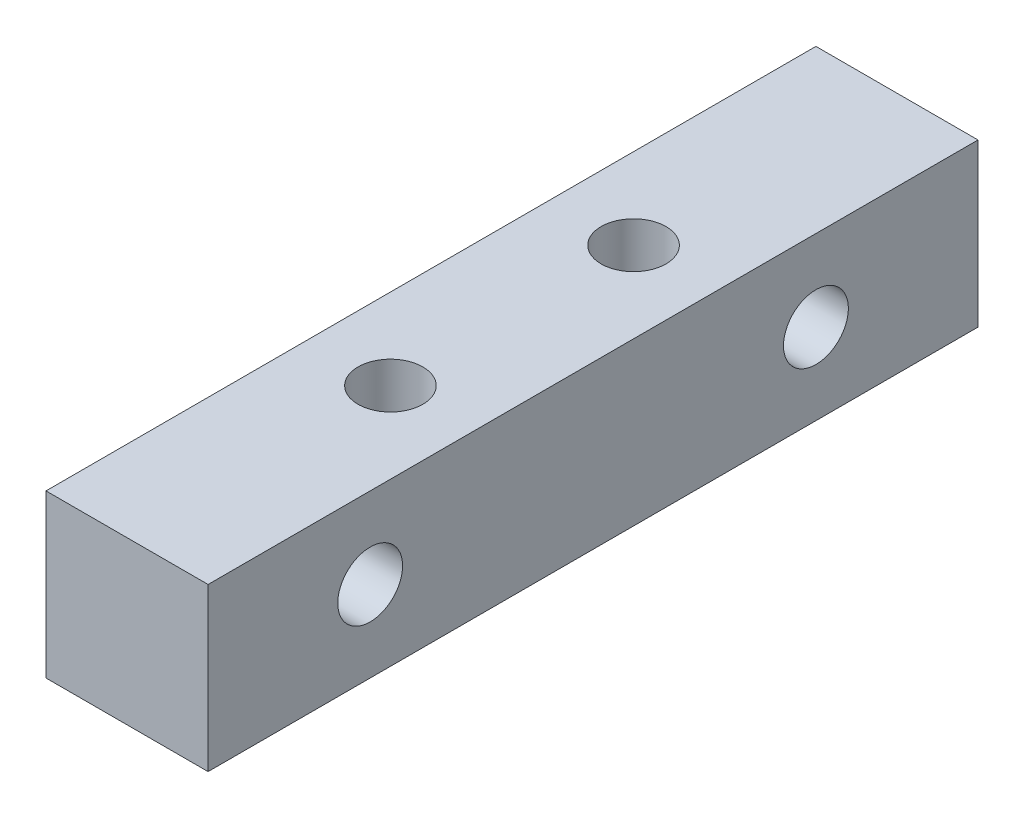
from build123d import *

# Parameters (mm, degrees)
SKETCH_1_W          = 8
SKETCH_1_H          = 8
EXTRUDE_1_DEPTH     = 38
SKETCH_3_R          = 1.6
CUT_EXTRUDE_1_DEPTH = 40.038442592
SKETCH_2_R          = 1.6
CUT_EXTRUDE_2_DEPTH = 40.038442592


with BuildPart() as part:
    # 草图1 → 凸台-拉伸1 (new body)
    with BuildSketch(Plane.XY):
        Rectangle(SKETCH_1_W, SKETCH_1_H)
    extrude(amount=EXTRUDE_1_DEPTH)

    # 草图3 → 切除-拉伸1 (cut, through all)
    with BuildSketch(Plane(origin=(0, 4, 0), x_dir=(1, 0, 0), z_dir=(0, 1, 0))):
        with Locations(Location((0, -13, 0), (0, 0, 270))):
            Circle(SKETCH_3_R)
        with Locations(Location((0, -25, 0), (0, 0, 90))):
            Circle(SKETCH_3_R)
    extrude(amount=-CUT_EXTRUDE_1_DEPTH, mode=Mode.SUBTRACT)

    # 草图2 → 切除-拉伸2 (cut, through all)
    with BuildSketch(Plane(origin=(4, 0, 0), x_dir=(0, 0, -1), z_dir=(1, 0, 0))):
        with Locations((-30, 0)):
            Circle(SKETCH_2_R)
        with Locations(Location((-8, 0, 0), (0, 0, 180))):
            Circle(SKETCH_2_R)
    extrude(amount=-CUT_EXTRUDE_2_DEPTH, mode=Mode.SUBTRACT)


solid = part.part
